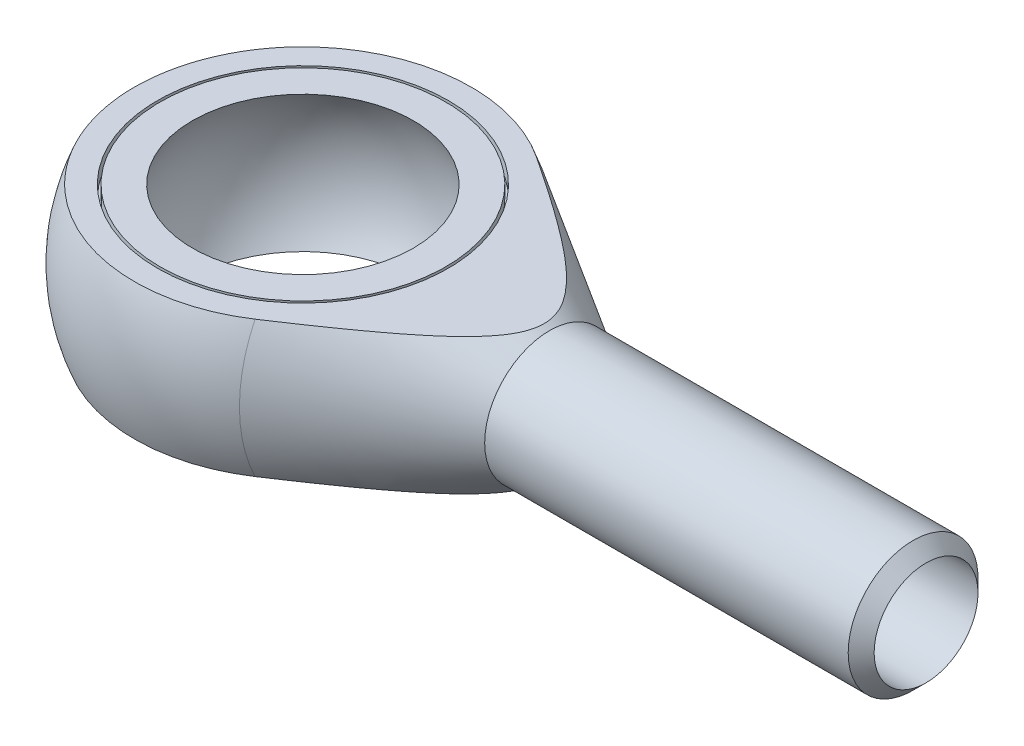
from build123d import *

# Parameters (mm, degrees)
CUT_EXTRUDE1_DEPTH      = 28.440845468
CUT_EXTRUDE1_DEPTH_BACK = 28.440845468
SKETCH3_W               = 33
SKETCH3_H               = 8.75
SKETCH4_W               = 0.2
SKETCH4_H               = 1
SKETCH5_R               = 5
BOSS_EXTRUDE1_DEPTH     = 29
CHAMFER1_SIZE           = 1
ESQUISSE1_R             = 4
ENL_V_MAT_EXTRU_1_DEPTH = 10


with BuildPart() as part:
    # Sketch2 → Revolve2 (revolve)
    with BuildSketch(Plane(origin=(0, 0, 0), x_dir=(1, 0, 0), z_dir=(0, 1, 0))):
        with BuildLine():
            Line((7.147970434, 12.037712352), (19, 5))
            Line((19, 5), (19, 0))
            Line((19, 0), (-14, 0))
            ThreePointArc((-14, 0), (-6.925619609, 12.166996056), (7.147970434, 12.037712352))
        make_face()
    revolve(axis=Axis((-39.456415939, 0, 0), (1, 0, 0)))

    # Sketch3 → Cut-Extrude1 (cut, two sides: drawn at the far end of the back side and taken through both)
    with BuildSketch(Plane.XY.offset(-CUT_EXTRUDE1_DEPTH_BACK)):
        with Locations((2.5, 9.625)):
            Rectangle(SKETCH3_W, SKETCH3_H)
        with Locations((2.5, -9.625)):
            Rectangle(SKETCH3_W, SKETCH3_H)
    extrude(amount=CUT_EXTRUDE1_DEPTH + CUT_EXTRUDE1_DEPTH_BACK, mode=Mode.SUBTRACT)

    # Sketch4 → Cut-Revolve1 (revolve, cut)
    with BuildSketch(Plane.XY):
        with BuildLine():
            Line((0, 10), (0, -10))
            ThreePointArc((0, -10), (10, 0), (0, 10))
        make_face()
        with Locations((11.1, 4.75)):
            Rectangle(SKETCH4_W, SKETCH4_H)
        with Locations((11.1, -4.75)):
            Rectangle(SKETCH4_W, SKETCH4_H)
    revolve(axis=Axis((0, 13.975998128, 0), (0, -1, 0)), mode=Mode.SUBTRACT)

    # Sketch5 → Boss-Extrude1 (add)
    with BuildSketch(Plane(origin=(19, 0, 0), x_dir=(0, 0, -1), z_dir=(1, 0, 0))):
        Circle(SKETCH5_R)
    extrude(amount=BOSS_EXTRUDE1_DEPTH)

    # Chamfer1
    chamfer1_edges = [part.edges().sort_by_distance(p)[0] for p in [
        (48, 0, 5),
    ]]
    chamfer(chamfer1_edges, length=CHAMFER1_SIZE)

    # Esquisse1 → Enlèv. mat.-Extru.1 (cut)
    with BuildSketch(Plane(origin=(48, 0, 0), x_dir=(0, 0, -1), z_dir=(1, 0, 0))):
        Circle(ESQUISSE1_R)
    extrude(amount=-ENL_V_MAT_EXTRU_1_DEPTH, mode=Mode.SUBTRACT)


solid = part.part
